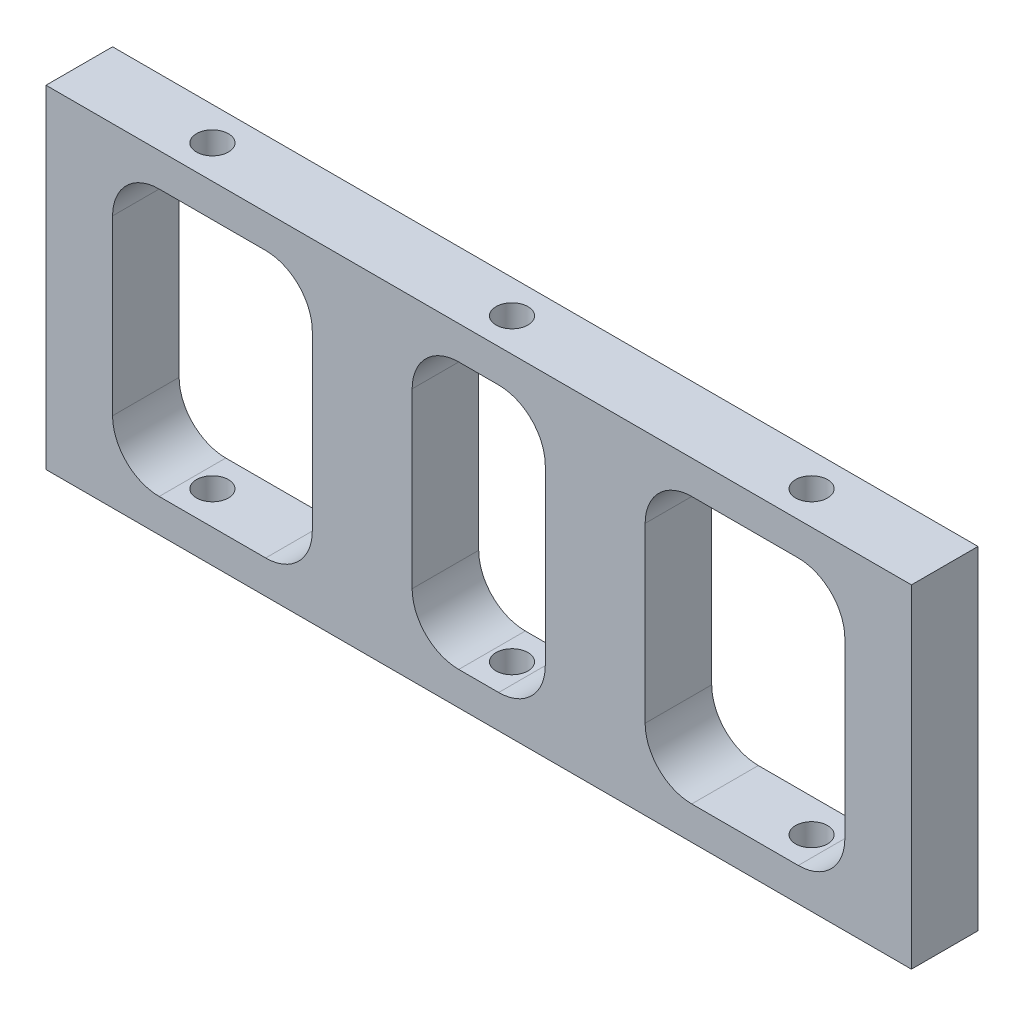
from build123d import *

# Parameters (mm, degrees)
ESQUISSE1_W             = 130
ESQUISSE1_H             = 50
ESQUISSE1_W_2           = 110
ESQUISSE1_H_2           = 40
ESQUISSE1_W_3           = 15
BOSS_EXTRU_1_DEPTH      = 10
ESQUISSE2_R             = 2.4
ENL_V_MAT_EXTRU_1_DEPTH = 140.642400438
CONG_1_R                = 7


with BuildPart() as part:
    # Esquisse1 → Boss.-Extru.1 (new body)
    # profile 1 of 3: a face of its own
    with BuildSketch(Plane.XY):
        with Locations((65, 25)):
            Rectangle(ESQUISSE1_W, ESQUISSE1_H)
        with Locations((65, 25)):
            Rectangle(ESQUISSE1_W_2, ESQUISSE1_H_2, mode=Mode.SUBTRACT)
    # profile 2 of 3: a face of its own
    with BuildSketch(Plane.XY):
        with Locations((47.5, 25)):
            Rectangle(ESQUISSE1_W_3, ESQUISSE1_H_2)
    # profile 3 of 3: a face of its own
    with BuildSketch(Plane.XY):
        with Locations((82.5, 25)):
            Rectangle(ESQUISSE1_W_3, ESQUISSE1_H_2)
    extrude(amount=BOSS_EXTRU_1_DEPTH)

    # Esquisse2 → Enlèv. mat.-Extru.1 (cut, through all)
    with BuildSketch(Plane(origin=(0, 50, 0), x_dir=(1, 0, 0), z_dir=(0, 1, 0))):
        with Locations(Location((20, -5, 0), (0, 0, 270))):
            Circle(ESQUISSE2_R)
        with Locations(Location((65, -5, 0), (0, 0, 270))):
            Circle(ESQUISSE2_R)
        with Locations(Location((110, -5, 0), (0, 0, 270))):
            Circle(ESQUISSE2_R)
    extrude(amount=-ENL_V_MAT_EXTRU_1_DEPTH, mode=Mode.SUBTRACT)

    # Congé1
    cong_1_edges = [part.edges().sort_by_distance(p)[0] for p in [
        (40, 45, 5),
        (10, 45, 5),
        (10, 5, 5),
        (40, 5, 5),
        (120, 5, 5),
        (120, 45, 5),
        (90, 45, 5),
        (90, 5, 5),
        (75, 5, 5),
        (75, 45, 5),
        (55, 45, 5),
        (55, 5, 5),
    ]]
    fillet(cong_1_edges, radius=CONG_1_R)


solid = part.part
